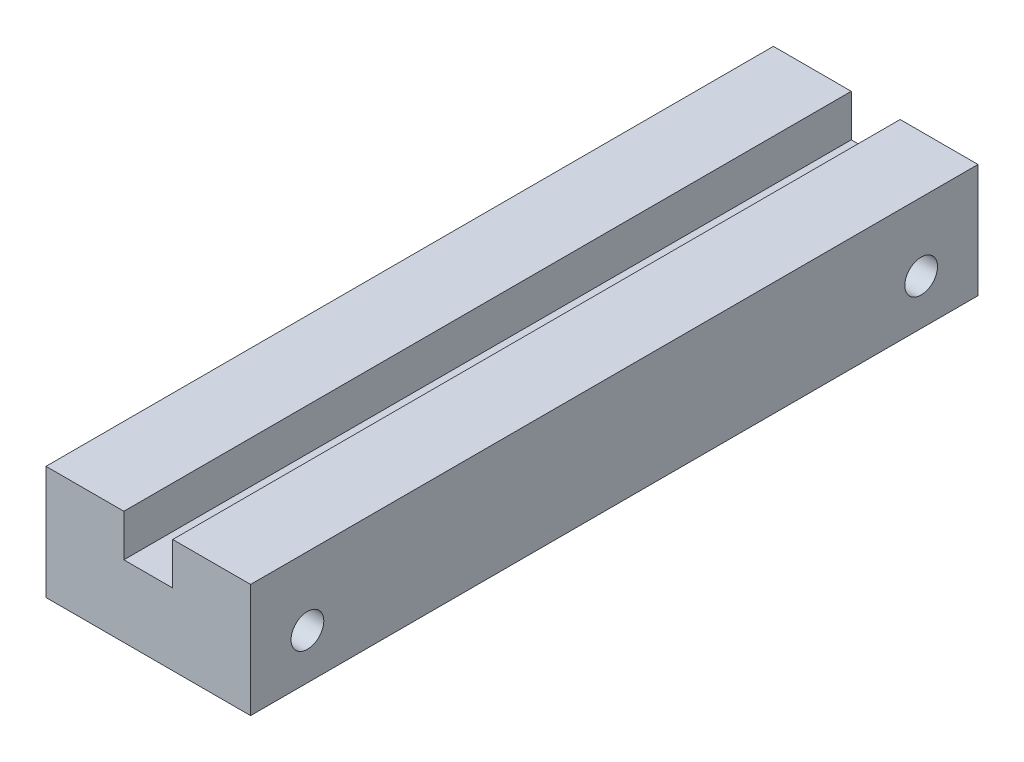
from build123d import *

# Parameters (mm, degrees)
SKETCH1_W           = 18
SKETCH1_H           = 10
BOSS_EXTRUDE2_DEPTH = 64
CUT_EXTRUDE1_REACH  = 69.231
SKETCH3_W           = 4.3
SKETCH3_H           = 3.7
SKETCH5_R           = 1.425
CUT_EXTRUDE3_DEPTH  = 4.5
SKETCH7_R           = 1.44113796
CUT_EXTRUDE5_DEPTH  = 10
SKETCH8_R           = 1.6
CUT_EXTRUDE6_DEPTH  = 10
SKETCH9_R           = 1.6
CUT_EXTRUDE7_DEPTH  = 42.5
SKETCH10_R          = 1.25
CUT_EXTRUDE8_DEPTH  = 6


with BuildPart() as part:
    # Sketch1 → Boss-Extrude2 (new body)
    with BuildSketch(Plane.XY):
        with Locations((9, 5)):
            Rectangle(SKETCH1_W, SKETCH1_H)
    extrude(amount=BOSS_EXTRUDE2_DEPTH)

    # Sketch3 → Cut-Extrude1 (cut, up to next)
    with BuildSketch(Plane(origin=(0, 0, 0), x_dir=(-1, 0, 0), z_dir=(0, 0, -1)), mode=Mode.PRIVATE) as cut_extrude1_sk1:
        with Locations((-9, 8.15)):
            Rectangle(SKETCH3_W, SKETCH3_H)
    cut_extrude1_tool1 = extrude(cut_extrude1_sk1.sketch, amount=-CUT_EXTRUDE1_REACH, mode=Mode.PRIVATE) & part.part
    add(cut_extrude1_tool1.solids().sort_by_distance((9, 8.15, 0))[0], mode=Mode.SUBTRACT)

    # Sketch5 → Cut-Extrude3 (cut)
    with BuildSketch(Plane(origin=(0, 6.3, 0), x_dir=(1, 0, 0), z_dir=(0, 1, 0))):
        with Locations(Location((9, -23, 0), (0, 0, 180))):
            Circle(SKETCH5_R)
        with Locations(Location((9, -41, 0), (0, 0, 180))):
            Circle(SKETCH5_R)
        with Locations(Location((9, -5, 0), (0, 0, 180))):
            Circle(SKETCH5_R)
        with Locations(Location((9, -59, 0), (0, 0, 180))):
            Circle(SKETCH5_R)
    extrude(amount=-CUT_EXTRUDE3_DEPTH, mode=Mode.SUBTRACT)

    # Sketch7 → Cut-Extrude5 (cut)
    with BuildSketch(Plane(origin=(18, 0, 0), x_dir=(0, 0, -1), z_dir=(1, 0, 0))):
        with Locations((-5, 4)):
            Circle(SKETCH7_R)
        with Locations((-59, 4)):
            Circle(SKETCH7_R)
    extrude(amount=-CUT_EXTRUDE5_DEPTH, mode=Mode.SUBTRACT)

    # Sketch8 → Cut-Extrude6 (cut)
    with BuildSketch(Plane.ZY):
        with Locations((23, 4)):
            Circle(SKETCH8_R)
        with Locations((41, 4)):
            Circle(SKETCH8_R)
    extrude(amount=-CUT_EXTRUDE6_DEPTH, mode=Mode.SUBTRACT)

    # Sketch9 → Cut-Extrude7 (cut)
    with BuildSketch(Plane(origin=(0, 0, 0), x_dir=(-1, 0, 0), z_dir=(0, 0, -1))):
        with Locations(Location((-4.5, 4, 0), (0, 0, 270))):
            Circle(SKETCH9_R)
    extrude(amount=-CUT_EXTRUDE7_DEPTH, mode=Mode.SUBTRACT)

    # Sketch10 → Cut-Extrude8 (cut)
    with BuildSketch(Plane.XZ):
        with Locations(Location((13.5, 19.5, 0), (0, 0, 270))):
            Circle(SKETCH10_R)
        with Locations(Location((13.5, 44.5, 0), (0, 0, 270))):
            Circle(SKETCH10_R)
    extrude(amount=-CUT_EXTRUDE8_DEPTH, mode=Mode.SUBTRACT)


solid = part.part
